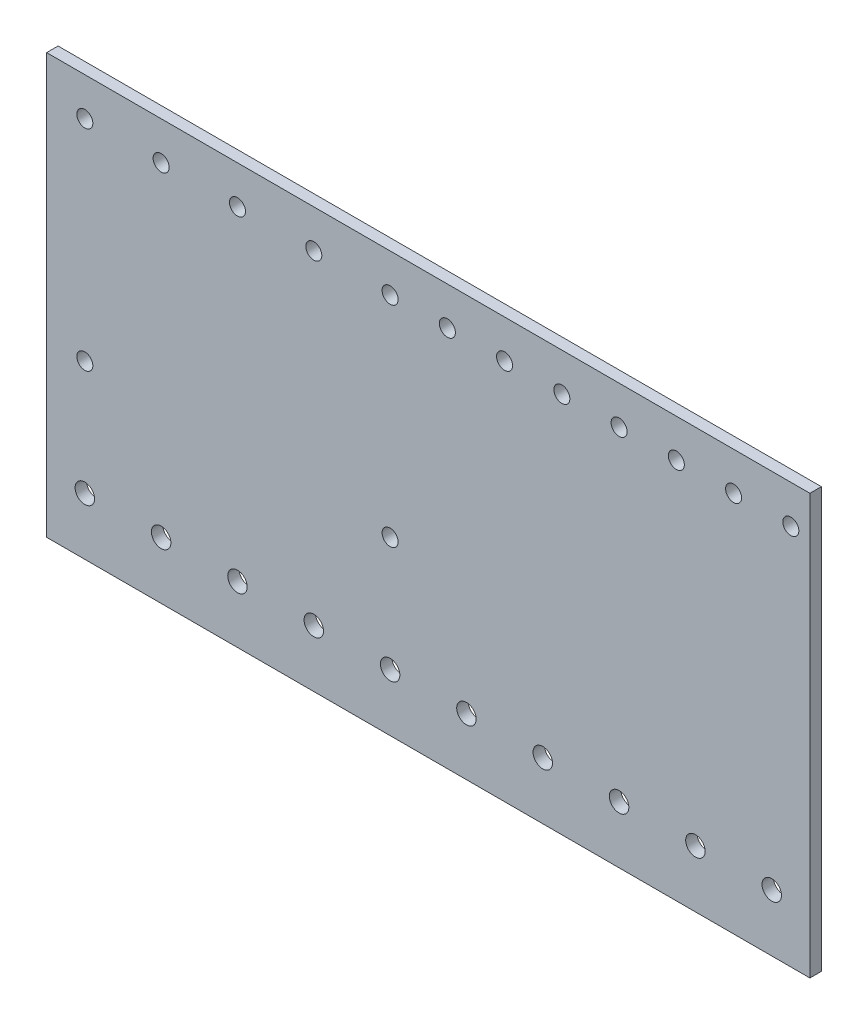
from build123d import *

# Parameters (mm, degrees)
SKETCH_1_W               = 100
SKETCH_1_H               = 130
EXTRUDE_1_DEPTH          = 3
SKETCH_2_R               = 2.1
CUT_EXTRUDE_1_DEPTH      = 83.060952956
SKETCH_5_W               = 100
SKETCH_5_H               = 130
EXTRUDE_2_DEPTH          = 3
CUT_EXTRUDE_4_DEPTH      = 164.505351594
CUT_EXTRUDE_4_DEPTH_BACK = 164.505351594
SKETCH_6_R               = 2.1
CUT_EXTRUDE_5_DEPTH      = 164.505351594
CUT_EXTRUDE_5_DEPTH_BACK = 164.505351594
SKETCH_7_R               = 2.55
CUT_EXTRUDE_6_DEPTH      = 164.505351594
CUT_EXTRUDE_6_DEPTH_BACK = 164.505351594
SKETCH_8_W               = 200
SKETCH_8_H               = 20


with BuildPart() as part:
    # 草图1 → 凸台-拉伸1 (new body)
    with BuildSketch(Plane.XY):
        Rectangle(SKETCH_1_W, SKETCH_1_H)
    extrude(amount=EXTRUDE_1_DEPTH)

    # 草图2 → 切除-拉伸1 (cut, through all)
    with BuildSketch(Plane.XY.offset(3)):
        with Locations((-40, 55)):
            Circle(SKETCH_2_R)
        with Locations((-20, 55)):
            Circle(SKETCH_2_R)
        with Locations((0, 55)):
            Circle(SKETCH_2_R)
        with Locations((20, 55)):
            Circle(SKETCH_2_R)
        with Locations((40, 55)):
            Circle(SKETCH_2_R)
        with Locations((-40, 0)):
            Circle(SKETCH_2_R)
        with Locations((-40, -55)):
            Circle(SKETCH_2_R)
        with Locations((-40, -110)):
            Circle(SKETCH_2_R)
        with Locations((-40, -165)):
            Circle(SKETCH_2_R)
        with Locations((-40, -220)):
            Circle(SKETCH_2_R)
        with Locations((-40, -275)):
            Circle(SKETCH_2_R)
        with Locations((-40, -330)):
            Circle(SKETCH_2_R)
        with Locations((-40, -385)):
            Circle(SKETCH_2_R)
        with Locations((40, -385)):
            Circle(SKETCH_2_R)
        with Locations((40, -330)):
            Circle(SKETCH_2_R)
        with Locations((40, -275)):
            Circle(SKETCH_2_R)
        with Locations((40, -220)):
            Circle(SKETCH_2_R)
        with Locations((40, -165)):
            Circle(SKETCH_2_R)
        with Locations((40, -110)):
            Circle(SKETCH_2_R)
        with Locations(Location((40, -55, 0), (0, 0, 180))):
            Circle(SKETCH_2_R)
        with Locations(Location((40, 0, 0), (0, 0, 180))):
            Circle(SKETCH_2_R)
        with Locations(Location((20, -55, 0), (0, 0, 180))):
            Circle(SKETCH_2_R)
        with Locations(Location((0, -55, 0), (0, 0, 180))):
            Circle(SKETCH_2_R)
        with Locations(Location((-20, -55, 0), (0, 0, 180))):
            Circle(SKETCH_2_R)
    extrude(amount=-CUT_EXTRUDE_1_DEPTH, mode=Mode.SUBTRACT)

    # 草图5 → 凸台-拉伸2 (add)
    with BuildSketch(Plane.XY.offset(3)):
        with Locations((100, 0)):
            Rectangle(SKETCH_5_W, SKETCH_5_H)
    extrude(amount=-EXTRUDE_2_DEPTH)

    # 草图6 → 切除-拉伸4 (cut, two sides: drawn at the far end of the back side and taken through both)
    with BuildSketch(Plane.XY.offset(3).offset(-CUT_EXTRUDE_4_DEPTH_BACK)):
        with Locations((55, 55)):
            Circle(SKETCH_6_R)
        with Locations((70, 55)):
            Circle(SKETCH_6_R)
        with Locations((85, 55)):
            Circle(SKETCH_6_R)
        with Locations((100, 55)):
            Circle(SKETCH_6_R)
        with Locations((115, 55)):
            Circle(SKETCH_6_R)
        with Locations((130, 55)):
            Circle(SKETCH_6_R)
        with Locations((145, 55)):
            Circle(SKETCH_6_R)
        with Locations((145, -55)):
            Circle(SKETCH_6_R)
        with Locations((130, -55)):
            Circle(SKETCH_6_R)
        with Locations((115, -55)):
            Circle(SKETCH_6_R)
        with Locations((100, -55)):
            Circle(SKETCH_6_R)
        with Locations((85, -55)):
            Circle(SKETCH_6_R)
        with Locations((70, -55)):
            Circle(SKETCH_6_R)
        with Locations((55, -55)):
            Circle(SKETCH_6_R)
    extrude(amount=CUT_EXTRUDE_4_DEPTH + CUT_EXTRUDE_4_DEPTH_BACK, mode=Mode.SUBTRACT)

    # 草图7 → 切除-拉伸5 (cut, two sides: drawn at the far end of the back side and taken through both)
    with BuildSketch(Plane(origin=(0, 0, 0), x_dir=(-1, 0, 0), z_dir=(0, 0, -1)).offset(-CUT_EXTRUDE_5_DEPTH_BACK)):
        with Locations((-140, -30)):
            Circle(SKETCH_7_R)
        with Locations((-120, -30)):
            Circle(SKETCH_7_R)
        with Locations((-100, -30)):
            Circle(SKETCH_7_R)
        with Locations((-80, -30)):
            Circle(SKETCH_7_R)
        with Locations((-60, -30)):
            Circle(SKETCH_7_R)
        with Locations((-40, -30)):
            Circle(SKETCH_7_R)
        with Locations((-20, -30)):
            Circle(SKETCH_7_R)
        with Locations((0, -30)):
            Circle(SKETCH_7_R)
        with Locations((20, -30)):
            Circle(SKETCH_7_R)
        with Locations((40, -30)):
            Circle(SKETCH_7_R)
    extrude(amount=CUT_EXTRUDE_5_DEPTH + CUT_EXTRUDE_5_DEPTH_BACK, mode=Mode.SUBTRACT)

    # 草图8 → 切除-拉伸6 (cut, two sides: drawn at the far end of the back side and taken through both)
    with BuildSketch(Plane(origin=(0, 0, 0), x_dir=(-1, 0, 0), z_dir=(0, 0, -1)).offset(-CUT_EXTRUDE_6_DEPTH_BACK)):
        with Locations((-50, -55)):
            Rectangle(SKETCH_8_W, SKETCH_8_H)
    extrude(amount=CUT_EXTRUDE_6_DEPTH + CUT_EXTRUDE_6_DEPTH_BACK, mode=Mode.SUBTRACT)


solid = part.part
